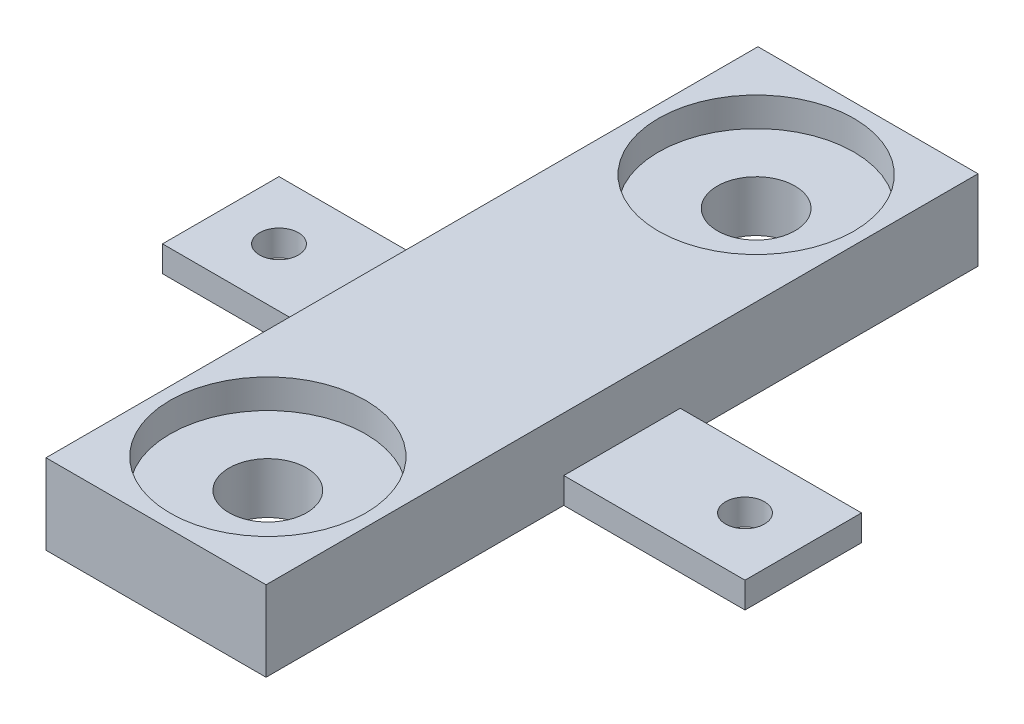
from build123d import *

# Parameters (mm, degrees)
SKETCH1_W           = 17
SKETCH1_H           = 55
SKETCH1_R           = 7.55
SKETCH1_W_2         = 14
SKETCH1_H_2         = 9
SKETCH1_R_2         = 1.5
BOSS_EXTRUDE1_DEPTH = 2
BOSS_EXTRUDE2_START = 2
SKETCH1_4_W         = 17
SKETCH1_4_H         = 55
SKETCH1_4_R         = 7.55
BOSS_EXTRUDE2_DEPTH = 1.94
BOSS_EXTRUDE3_START = 3.94
SKETCH1_5_W         = 17
SKETCH1_5_H         = 55
SKETCH1_5_R         = 7.55
BOSS_EXTRUDE3_DEPTH = 2.25
SKETCH3_R           = 3
CUT_EXTRUDE1_DEPTH  = 37.06682825


with BuildPart() as part:
    # Sketch1 → Boss-Extrude1 (new body)
    # profile 1 of 5: a face of its own
    with BuildSketch(Plane(origin=(0, 0, 0), x_dir=(1, 0, 0), z_dir=(0, 1, 0))):
        Rectangle(SKETCH1_W, SKETCH1_H)
        with Locations((0, -18.8625)):
            Circle(SKETCH1_R, mode=Mode.SUBTRACT)
        with Locations((0, 18.8625)):
            Circle(SKETCH1_R, mode=Mode.SUBTRACT)
    # profile 2 of 5: a face of its own
    with BuildSketch(Plane(origin=(0, 0, 0), x_dir=(1, 0, 0), z_dir=(0, 1, 0))):
        with Locations((15.5, 0)):
            Rectangle(SKETCH1_W_2, SKETCH1_H_2)
        with Locations(Location((18, 0, 0), (0, 0, 270))):
            Circle(SKETCH1_R_2, mode=Mode.SUBTRACT)
    # profile 3 of 5: a face of its own
    with BuildSketch(Plane(origin=(0, 0, 0), x_dir=(1, 0, 0), z_dir=(0, 1, 0))):
        with Locations((-15.5, 0)):
            Rectangle(SKETCH1_W_2, SKETCH1_H_2)
        with Locations(Location((-18, 0, 0), (0, 0, 270))):
            Circle(SKETCH1_R_2, mode=Mode.SUBTRACT)
    # profile 4 of 5: a face of its own
    with BuildSketch(Plane(origin=(0, 0, 0), x_dir=(1, 0, 0), z_dir=(0, 1, 0))):
        with Locations((0, -18.8625)):
            Circle(SKETCH1_R)
    # profile 5 of 5: a face of its own
    with BuildSketch(Plane(origin=(0, 0, 0), x_dir=(1, 0, 0), z_dir=(0, 1, 0))):
        with Locations((0, 18.8625)):
            Circle(SKETCH1_R)
    extrude(amount=BOSS_EXTRUDE1_DEPTH)

    # Sketch1<4> → Boss-Extrude2 (add)
    # profile 1 of 3: a face of its own
    with BuildSketch(Plane(origin=(0, 0, 0), x_dir=(1, 0, 0), z_dir=(0, 1, 0)).offset(BOSS_EXTRUDE2_START)):
        Rectangle(SKETCH1_4_W, SKETCH1_4_H)
        with Locations((0, -18.8625)):
            Circle(SKETCH1_4_R, mode=Mode.SUBTRACT)
        with Locations((0, 18.8625)):
            Circle(SKETCH1_4_R, mode=Mode.SUBTRACT)
    # profile 2 of 3: a face of its own
    with BuildSketch(Plane(origin=(0, 0, 0), x_dir=(1, 0, 0), z_dir=(0, 1, 0)).offset(BOSS_EXTRUDE2_START)):
        with Locations((0, -18.8625)):
            Circle(SKETCH1_4_R)
    # profile 3 of 3: a face of its own
    with BuildSketch(Plane(origin=(0, 0, 0), x_dir=(1, 0, 0), z_dir=(0, 1, 0)).offset(BOSS_EXTRUDE2_START)):
        with Locations((0, 18.8625)):
            Circle(SKETCH1_4_R)
    extrude(amount=BOSS_EXTRUDE2_DEPTH)

    # Sketch1<5> → Boss-Extrude3 (add)
    with BuildSketch(Plane(origin=(0, 0, 0), x_dir=(1, 0, 0), z_dir=(0, 1, 0)).offset(BOSS_EXTRUDE3_START)):
        Rectangle(SKETCH1_5_W, SKETCH1_5_H)
        with Locations(Location((0, -18.8625, 0), (0, 0, 90))):
            Circle(SKETCH1_5_R, mode=Mode.SUBTRACT)
        with Locations(Location((0, 18.8625, 0), (0, 0, 90))):
            Circle(SKETCH1_5_R, mode=Mode.SUBTRACT)
    extrude(amount=BOSS_EXTRUDE3_DEPTH)

    # Sketch3 → Cut-Extrude1 (cut, through all)
    with BuildSketch(Plane.XZ):
        with Locations(Location((0, -18.8625, 0), (0, 0, 270))):
            Circle(SKETCH3_R)
        with Locations(Location((0, 18.8625, 0), (0, 0, 270))):
            Circle(SKETCH3_R)
    extrude(amount=-CUT_EXTRUDE1_DEPTH, mode=Mode.SUBTRACT)


solid = part.part
